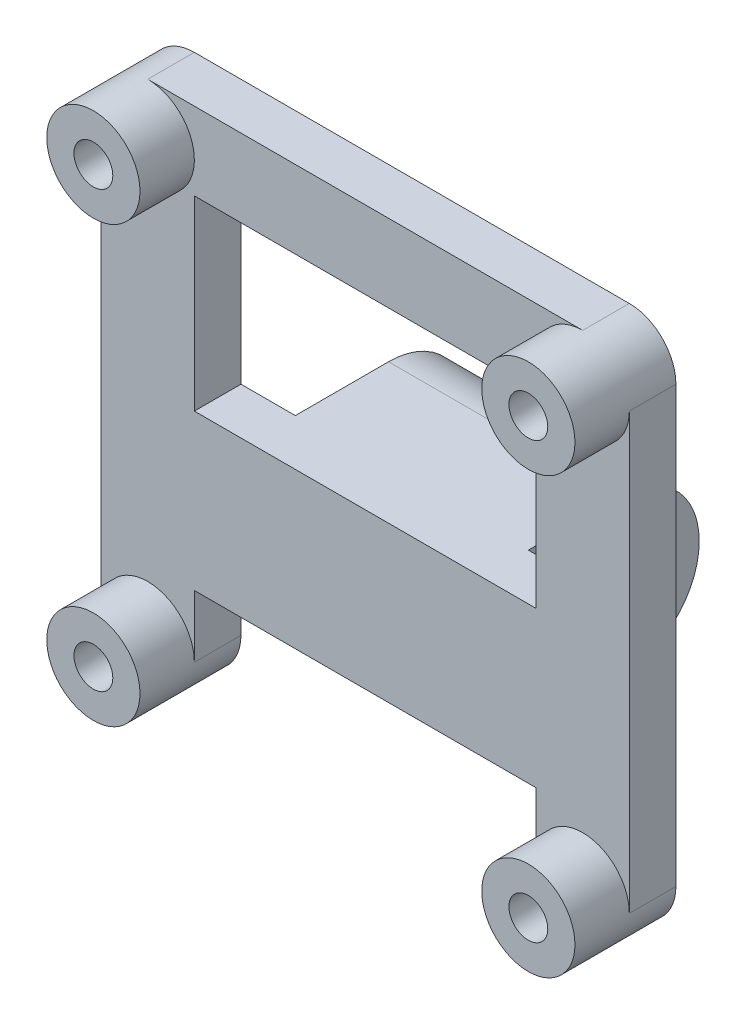
from build123d import *

# Parameters (mm, degrees)
ESQUISSE1_W                  = 22
ESQUISSE1_H                  = 12
BOSS_EXTRU_1_DEPTH           = 3
ESQUISSE3_R                  = 3
BOSS_EXTRU_3_DEPTH           = 3.5
ESQUISSE4_R                  = 1.25
ENL_V_MAT_EXTRU_1_DEPTH      = 28.789386463
BOSS_EXTRU_4_DEPTH           = 7.5
ENL_V_MAT_EXTRU_2_DEPTH      = 30.171904292
ENL_V_MAT_EXTRU_2_DEPTH_BACK = 30.171904292
ESQUISSE6_R                  = 3


with BuildPart() as part:
    # Esquisse1 → Boss.-Extru.1 (new body)
    with BuildSketch(Plane.XY):
        with BuildLine():
            Line((-17, -14), (-17, -18))
            ThreePointArc((-17, -18), (-14, -21), (-11, -18))
            Line((-11, -18), (-11, -14))
            Line((-11, -14), (11, -14))
            Line((11, -14), (11, -18))
            ThreePointArc((11, -18), (14, -21), (17, -18))
            Line((17, -18), (17, -14))
            Line((17, -14), (17, 10))
            ThreePointArc((17, 10), (16.121320344, 12.121320344), (14, 13))
            Line((14, 13), (-14, 13))
            ThreePointArc((-14, 13), (-16.121320344, 12.121320344), (-17, 10))
            Line((-17, 10), (-17, -14))
        make_face()
        with Locations((0, 2)):
            Rectangle(ESQUISSE1_W, ESQUISSE1_H, mode=Mode.SUBTRACT)
    extrude(amount=BOSS_EXTRU_1_DEPTH)

    # Esquisse3 → Boss.-Extru.3 (add)
    with BuildSketch(Plane.XY.offset(3)):
        with Locations((14, 10)):
            Circle(ESQUISSE3_R)
        with Locations(Location((-14, 10, 0), (0, 0, 180))):
            Circle(ESQUISSE3_R)
        with Locations((-14, -18)):
            Circle(ESQUISSE3_R)
        with Locations((14, -18)):
            Circle(ESQUISSE3_R)
    extrude(amount=BOSS_EXTRU_3_DEPTH)

    # Esquisse4 → Enlèv. mat.-Extru.1 (cut, through all)
    with BuildSketch(Plane.XY.offset(6.5)):
        with Locations((-14, 10)):
            Circle(ESQUISSE4_R)
        with Locations((14, 10)):
            Circle(ESQUISSE4_R)
        with Locations((-14, -18)):
            Circle(ESQUISSE4_R)
        with Locations((14, -18)):
            Circle(ESQUISSE4_R)
    extrude(amount=-ENL_V_MAT_EXTRU_1_DEPTH, mode=Mode.SUBTRACT)

    # Esquisse5 → Boss.-Extru.4 (add, symmetric)
    with BuildSketch(Plane(origin=(0, 0, 0), x_dir=(0, 0, -1), z_dir=(1, 0, 0))):
        with BuildLine():
            Line((6, -14), (0, -14))
            Line((0, -14), (0, -4))
            Line((0, -4), (6, -4))
            ThreePointArc((6, -4), (11, -9), (6, -14))
        make_face()
    extrude(amount=BOSS_EXTRU_4_DEPTH, both=True)

    # Esquisse6 → Enlèv. mat.-Extru.2 (cut, two sides: drawn at the far end of the back side and taken through both)
    with BuildSketch(Plane(origin=(0, 0, 0), x_dir=(0, 0, -1), z_dir=(1, 0, 0)).offset(-ENL_V_MAT_EXTRU_2_DEPTH_BACK)):
        with Locations(Location((6, -9, 0), (0, 0, 180))):
            Circle(ESQUISSE6_R)
    extrude(amount=ENL_V_MAT_EXTRU_2_DEPTH + ENL_V_MAT_EXTRU_2_DEPTH_BACK, mode=Mode.SUBTRACT)


solid = part.part
